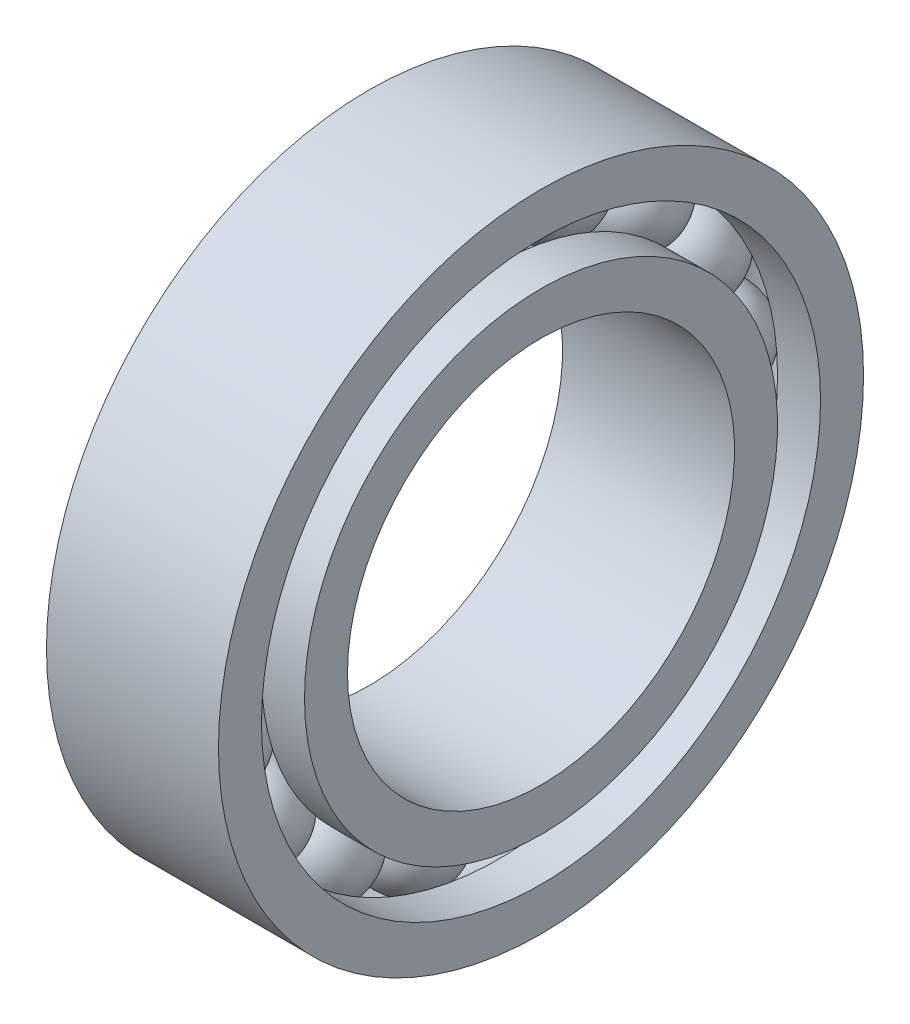
from build123d import *

# Parameters (mm, degrees)
RIPETIZIONECIRCOLARE2_COUNT = 17


with BuildPart() as part:
    # Schizzo2 → Rivoluzione1 (revolve)
    with BuildSketch(Plane.XY, mode=Mode.PRIVATE) as rivoluzione1_sk:
        with BuildLine():
            Line((20, 0), (-20, 0))
            Line((-20, 0), (-20, 10))
            Line((-20, 10), (-10, 10))
            ThreePointArc((-10, 10), (0, 3.819660113), (10, 10))
            Line((10, 10), (20, 10))
            Line((20, 10), (20, 0))
        make_face()
        with BuildLine():
            Line((20, 30), (20, 20))
            Line((20, 20), (10, 20))
            ThreePointArc((10, 20), (0, 26.180339887), (-10, 20))
            Line((-10, 20), (-20, 20))
            Line((-20, 20), (-20, 30))
            Line((-20, 30), (20, 30))
        make_face()
    revolve(rivoluzione1_sk.sketch.rotate(Axis((0, -45, 0), (1, 0, 0)), 90), axis=Axis((0, -45, 0), (1, 0, 0)))


with BuildPart() as body_2:
    # Schizzo4 → Rivoluzione3 (revolve)
    with BuildSketch(Plane.XY):
        with BuildLine():
            Line((-11, 15), (11, 15))
            ThreePointArc((11, 15), (0, 4), (-11, 15))
        make_face()
    revolve(axis=Axis((-11, 15, 0), (1, 0, 0)))


with BuildPart() as ripetizionecircolare2_1:
    # RipetizioneCircolare2: pattern copy
    add(body_2.part.rotate(Axis((0, -45, 0), (1, 0, 0)), 1 * 360 / RIPETIZIONECIRCOLARE2_COUNT))


with BuildPart() as ripetizionecircolare2_2:
    # RipetizioneCircolare2: pattern copy
    add(body_2.part.rotate(Axis((0, -45, 0), (1, 0, 0)), 2 * 360 / RIPETIZIONECIRCOLARE2_COUNT))


with BuildPart() as ripetizionecircolare2_3:
    # RipetizioneCircolare2: pattern copy
    add(body_2.part.rotate(Axis((0, -45, 0), (1, 0, 0)), 3 * 360 / RIPETIZIONECIRCOLARE2_COUNT))


with BuildPart() as ripetizionecircolare2_4:
    # RipetizioneCircolare2: pattern copy
    add(body_2.part.rotate(Axis((0, -45, 0), (1, 0, 0)), 4 * 360 / RIPETIZIONECIRCOLARE2_COUNT))


with BuildPart() as ripetizionecircolare2_5:
    # RipetizioneCircolare2: pattern copy
    add(body_2.part.rotate(Axis((0, -45, 0), (1, 0, 0)), 5 * 360 / RIPETIZIONECIRCOLARE2_COUNT))


with BuildPart() as ripetizionecircolare2_6:
    # RipetizioneCircolare2: pattern copy
    add(body_2.part.rotate(Axis((0, -45, 0), (1, 0, 0)), 6 * 360 / RIPETIZIONECIRCOLARE2_COUNT))


with BuildPart() as ripetizionecircolare2_7:
    # RipetizioneCircolare2: pattern copy
    add(body_2.part.rotate(Axis((0, -45, 0), (1, 0, 0)), 7 * 360 / RIPETIZIONECIRCOLARE2_COUNT))


with BuildPart() as ripetizionecircolare2_8:
    # RipetizioneCircolare2: pattern copy
    add(body_2.part.rotate(Axis((0, -45, 0), (1, 0, 0)), 8 * 360 / RIPETIZIONECIRCOLARE2_COUNT))


with BuildPart() as ripetizionecircolare2_9:
    # RipetizioneCircolare2: pattern copy
    add(body_2.part.rotate(Axis((0, -45, 0), (1, 0, 0)), 9 * 360 / RIPETIZIONECIRCOLARE2_COUNT))


with BuildPart() as ripetizionecircolare2_10:
    # RipetizioneCircolare2: pattern copy
    add(body_2.part.rotate(Axis((0, -45, 0), (1, 0, 0)), 10 * 360 / RIPETIZIONECIRCOLARE2_COUNT))


with BuildPart() as ripetizionecircolare2_11:
    # RipetizioneCircolare2: pattern copy
    add(body_2.part.rotate(Axis((0, -45, 0), (1, 0, 0)), 11 * 360 / RIPETIZIONECIRCOLARE2_COUNT))


with BuildPart() as ripetizionecircolare2_12:
    # RipetizioneCircolare2: pattern copy
    add(body_2.part.rotate(Axis((0, -45, 0), (1, 0, 0)), 12 * 360 / RIPETIZIONECIRCOLARE2_COUNT))


with BuildPart() as ripetizionecircolare2_13:
    # RipetizioneCircolare2: pattern copy
    add(body_2.part.rotate(Axis((0, -45, 0), (1, 0, 0)), 13 * 360 / RIPETIZIONECIRCOLARE2_COUNT))


with BuildPart() as ripetizionecircolare2_14:
    # RipetizioneCircolare2: pattern copy
    add(body_2.part.rotate(Axis((0, -45, 0), (1, 0, 0)), 14 * 360 / RIPETIZIONECIRCOLARE2_COUNT))


with BuildPart() as ripetizionecircolare2_15:
    # RipetizioneCircolare2: pattern copy
    add(body_2.part.rotate(Axis((0, -45, 0), (1, 0, 0)), 15 * 360 / RIPETIZIONECIRCOLARE2_COUNT))


with BuildPart() as ripetizionecircolare2_16:
    # RipetizioneCircolare2: pattern copy
    add(body_2.part.rotate(Axis((0, -45, 0), (1, 0, 0)), 16 * 360 / RIPETIZIONECIRCOLARE2_COUNT))


solid = Compound([part.part, body_2.part, ripetizionecircolare2_1.part, ripetizionecircolare2_2.part, ripetizionecircolare2_3.part, ripetizionecircolare2_4.part, ripetizionecircolare2_5.part, ripetizionecircolare2_6.part, ripetizionecircolare2_7.part, ripetizionecircolare2_8.part, ripetizionecircolare2_9.part, ripetizionecircolare2_10.part, ripetizionecircolare2_11.part, ripetizionecircolare2_12.part, ripetizionecircolare2_13.part, ripetizionecircolare2_14.part, ripetizionecircolare2_15.part, ripetizionecircolare2_16.part])
